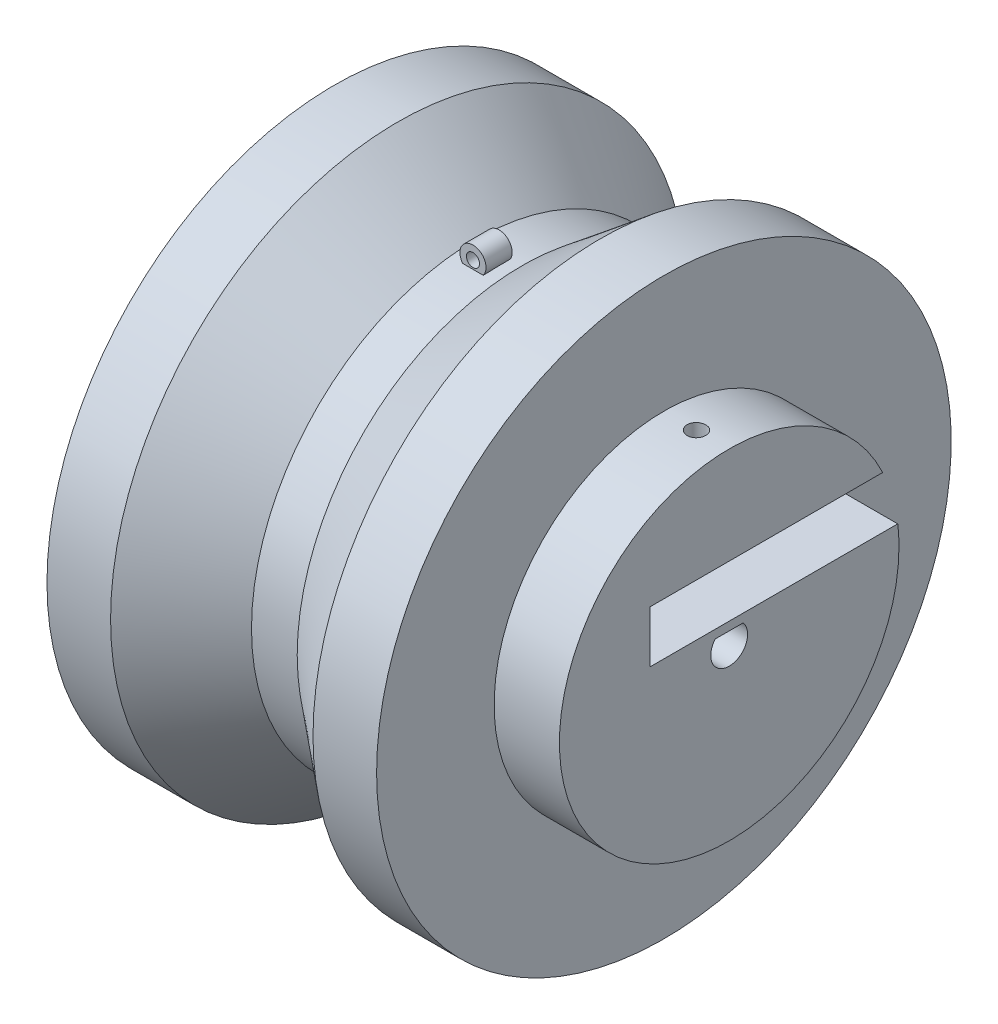
from build123d import *

# Parameters (mm, degrees)
SKETCH_3_R                = 2.825
CUT_EXTRUDE_2_DEPTH       = 35
SKETCH_16_W               = 5.008881277
SKETCH_16_H               = 1
EXTRUDE_2_DEPTH           = 30
SKETCH_19_W               = 0.959066555
SKETCH_19_H               = 0.511502163
EXTRUDE_3_DEPTH           = 30
SKETCH_24_W               = 45.827715764
SKETCH_24_H               = 4
CUT_EXTRUDE_8_DEPTH       = 9
SKETCH_25_R               = 1.43
CUT_EXTRUDE_9_DEPTH       = 22
SKETCH_27_R               = 2
SKETCH_27_R_2             = 1
EXTRUDE_2_2_DEPTH         = 4
SKETCH_28_R               = 1.43
CUT_EXTRUDE_11_DEPTH      = 25
CUT_EXTRUDE_12_DEPTH      = 12.15
CUT_EXTRUDE_12_DEPTH_BACK = 35
SKETCH_29_W               = 9
SKETCH_29_H               = 3.960677992
SKETCH_30_R               = 47
SKETCH_30_R_2             = 26
CUT_EXTRUDE_1_DEPTH       = 10


with BuildPart() as part:
    # 草圖1 → 旋轉1 (revolve)
    with BuildSketch(Plane.XY, mode=Mode.PRIVATE) as revolve_1_sk:
        Polygon((0, 0), (0, 44), (9.74, 44), (21.74, 34.418858447), (28.74, 34.418858447), (40.74, 44), (50.48, 44), (50.48, 34.418858447), (60.48, 34.418858447), (60.48, 0), align=None)
    revolve(revolve_1_sk.sketch.rotate(Axis((-743.15639781, 0, 0), (1, 0, 0)), 90), axis=Axis((-743.15639781, 0, 0), (1, 0, 0)))

    # 草圖3 → 除料-伸長2 (cut)
    with BuildSketch(Plane(origin=(60.48, 0, 0), x_dir=(0, 0, -1), z_dir=(1, 0, 0))):
        Circle(SKETCH_3_R)
    extrude(amount=-CUT_EXTRUDE_2_DEPTH, mode=Mode.SUBTRACT)

    # 草圖16 → Extrude 2 (add)
    with BuildSketch(Plane(origin=(60.48, 0, 0), x_dir=(0, 0, -1), z_dir=(1, 0, 0))):
        with Locations((-0.105543204, 2.350977924)):
            Rectangle(SKETCH_16_W, SKETCH_16_H)
    extrude(amount=-EXTRUDE_2_DEPTH)

    # 草圖19 → 填料-伸長3 (add)
    with BuildSketch(Plane(origin=(60.48, 0, 0), x_dir=(0, 0, -1), z_dir=(1, 0, 0))):
        with Locations((-0.084116996, 2.673942601)):
            Rectangle(SKETCH_19_W, SKETCH_19_H)
    extrude(amount=-EXTRUDE_3_DEPTH)

    # 草圖24 → 除料-伸長8 (cut)
    with BuildSketch(Plane(origin=(60.48, 0, 0), x_dir=(0, 0, -1), z_dir=(1, 0, 0))):
        with Locations((10.762797737, 9.109197083)):
            Rectangle(SKETCH_24_W, SKETCH_24_H)
    extrude(amount=-CUT_EXTRUDE_8_DEPTH, mode=Mode.SUBTRACT)

    # 草圖25 → 除料-伸長9 (cut)
    with BuildSketch(Plane(origin=(0, 22, 0), x_dir=(1, 0, 0), z_dir=(0, 1, 0))):
        with Locations(Location((29.956679037, 0, 0), (0, 0, 270))):
            Circle(SKETCH_25_R)
    extrude(amount=-CUT_EXTRUDE_9_DEPTH, mode=Mode.SUBTRACT)

    # 草圖27 → Extrude 2 2 (add)
    with BuildSketch(Plane.XY):
        with Locations((25.24, 35.418858447)):
            Circle(SKETCH_27_R)
        with Locations((25.24, 35.418858447)):
            Circle(SKETCH_27_R_2, mode=Mode.SUBTRACT)
    extrude(amount=EXTRUDE_2_2_DEPTH)

    # 草圖28 → 除料-伸長11 (cut)
    with BuildSketch(Plane(origin=(0, 35, 0), x_dir=(1, 0, 0), z_dir=(0, 1, 0))):
        with Locations(Location((55.48, 0, 0), (0, 0, 270))):
            Circle(SKETCH_28_R)
    extrude(amount=-CUT_EXTRUDE_11_DEPTH, mode=Mode.SUBTRACT)

    # 草圖29 → 除料-伸長12 (cut, two sides: drawn at the far end of the back side and taken through both)
    with BuildSketch(Plane.XY.offset(-CUT_EXTRUDE_12_DEPTH_BACK)):
        with Locations((55.98, 5.128858087)):
            Rectangle(SKETCH_29_W, SKETCH_29_H)
    extrude(amount=CUT_EXTRUDE_12_DEPTH + CUT_EXTRUDE_12_DEPTH_BACK, mode=Mode.SUBTRACT)

    # 草圖30 → 除料-伸長-薄件1 (cut)
    with BuildSketch(Plane(origin=(60.48, 0, 0), x_dir=(0, 0, -1), z_dir=(1, 0, 0))):
        Circle(SKETCH_30_R)
        Circle(SKETCH_30_R_2, mode=Mode.SUBTRACT)
    extrude(amount=-CUT_EXTRUDE_1_DEPTH, mode=Mode.SUBTRACT)


solid = part.part
